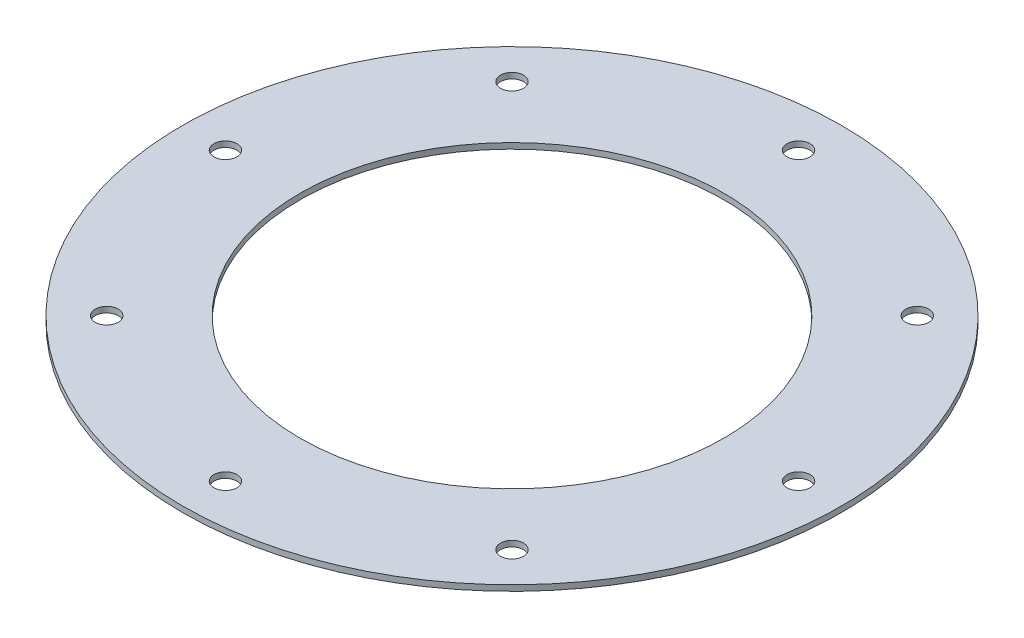
from build123d import *

# Parameters (mm, degrees)
SKETCH1_R           = 115
SKETCH1_R_2         = 74
SKETCH1_R_3         = 4
BOSS_EXTRUDE1_DEPTH = 2


with BuildPart() as part:
    # Sketch1 → Boss-Extrude1 (new body)
    with BuildSketch(Plane(origin=(0, 0, 0), x_dir=(1, 0, 0), z_dir=(0, 1, 0))):
        with Locations(Location((0, 0, 0), (0, 0, 270))):
            Circle(SKETCH1_R)
        with Locations(Location((0, 0, 0), (0, 0, 270))):
            Circle(SKETCH1_R_2, mode=Mode.SUBTRACT)
        with Locations(Location((-100, 0, 0), (0, 0, 270))):
            Circle(SKETCH1_R_3, mode=Mode.SUBTRACT)
        with Locations(Location((-70.710678119, 70.710678119, 0), (0, 0, 270))):
            Circle(SKETCH1_R_3, mode=Mode.SUBTRACT)
        with Locations(Location((0, 100, 0), (0, 0, 270))):
            Circle(SKETCH1_R_3, mode=Mode.SUBTRACT)
        with Locations(Location((70.710678119, 70.710678119, 0), (0, 0, 270))):
            Circle(SKETCH1_R_3, mode=Mode.SUBTRACT)
        with Locations(Location((100, 0, 0), (0, 0, 270))):
            Circle(SKETCH1_R_3, mode=Mode.SUBTRACT)
        with Locations(Location((70.710678119, -70.710678119, 0), (0, 0, 270))):
            Circle(SKETCH1_R_3, mode=Mode.SUBTRACT)
        with Locations(Location((0, -100, 0), (0, 0, 270))):
            Circle(SKETCH1_R_3, mode=Mode.SUBTRACT)
        with Locations(Location((-70.710678119, -70.710678119, 0), (0, 0, 270))):
            Circle(SKETCH1_R_3, mode=Mode.SUBTRACT)
    extrude(amount=BOSS_EXTRUDE1_DEPTH)


solid = part.part
